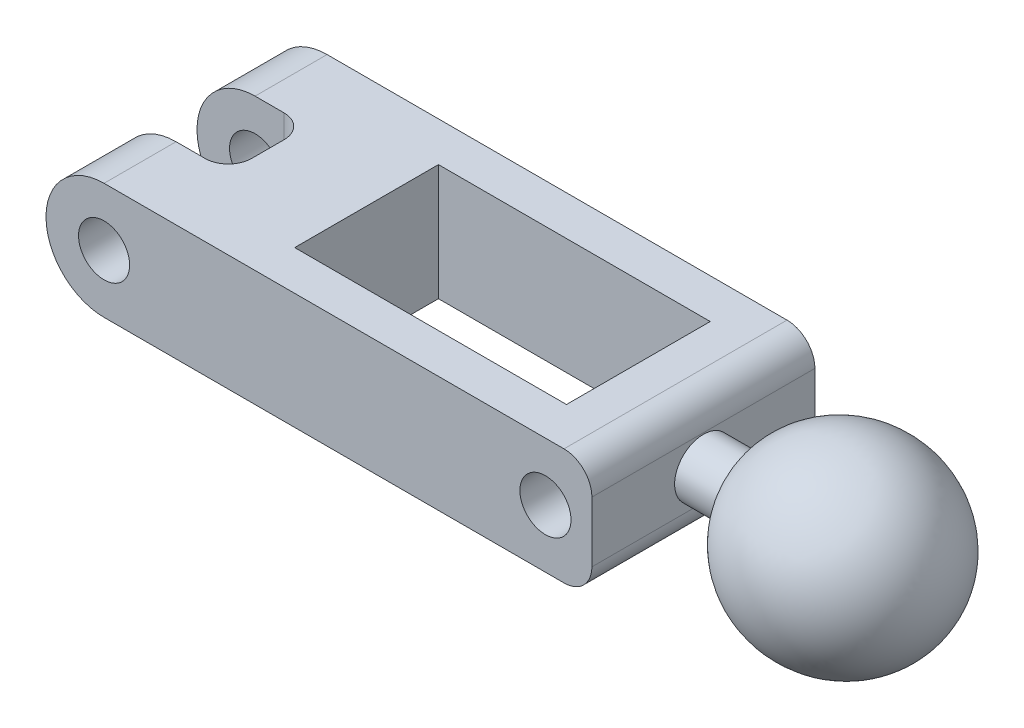
from build123d import *

# Parameters (mm, degrees)
SKETCH1_R           = 1.1
BOSS_EXTRUDE1_DEPTH = 4.8
SKETCH2_W           = 11.7
SKETCH2_H           = 6.188
SKETCH2_W_2         = 4.75
SKETCH2_H_2         = 3.4
CUT_EXTRUDE1_DEPTH  = 4.8
FILLET1_R           = 1


with BuildPart() as part:
    # Sketch1 → Boss-Extrude1 (new, symmetric)
    with BuildSketch(Plane.XY):
        with BuildLine():
            Line((-9.5, -2.5), (9.5, -2.5))
            Line((9.5, -2.5), (10.3, -2.5))
            ThreePointArc((10.3, -2.5), (11.148528137, -2.148528137), (11.5, -1.3))
            Line((11.5, -1.3), (11.5, -0.801473335))
            Line((11.5, -0.801473335), (11.5, 1.3))
            ThreePointArc((11.5, 1.3), (11.148528137, 2.148528137), (10.3, 2.5))
            Line((10.3, 2.5), (9.5, 2.5))
            Line((9.5, 2.5), (-9.5, 2.5))
            ThreePointArc((-9.5, 2.5), (-12, 0), (-9.5, -2.5))
        make_face()
        with Locations((-9.5, 0)):
            Circle(SKETCH1_R, mode=Mode.SUBTRACT)
        with Locations((9.5, 0)):
            Circle(SKETCH1_R, mode=Mode.SUBTRACT)
    extrude(amount=BOSS_EXTRUDE1_DEPTH, both=True)

    # Sketch2 → Cut-Extrude1 (cut, symmetric)
    with BuildSketch(Plane(origin=(0, 0, 0), x_dir=(1, 0, 0), z_dir=(0, 1, 0))):
        with Locations((2.85, 0)):
            Rectangle(SKETCH2_W, SKETCH2_H)
        with Locations((-9.625, 0)):
            Rectangle(SKETCH2_W_2, SKETCH2_H_2)
    extrude(amount=CUT_EXTRUDE1_DEPTH, both=True, mode=Mode.SUBTRACT)

    # Sketch6 → Revolve5 (revolve)
    with BuildSketch(Plane.XY):
        with BuildLine():
            Line((11.5, -1.24), (13.5, -1.24))
            add(Edge.make_bspline(
                [(13.5, -1.24), (14.590825895, -4.518170639), (18.155142557, -3.978926497), (21.719459219, -3.439682355), (21.696199677, 0)],
                knots=[3.442238671, 3.442238671, 3.442238671, 4.862711989, 4.862711989, 6.283185307, 6.283185307, 6.283185307], degree=2, weights=[1, 0.758207592, 1, 0.758207592, 1]))
            Line((21.696199677, 0), (11.5, 0))
            Line((11.5, 0), (11.5, -1.24))
        make_face()
    revolve(axis=Axis((11.5, 0, 0), (1, 0, 0)))

    # Fillet1
    fillet1_edges = [part.edges().sort_by_distance(p)[0] for p in [
        (-7.25, 0, 1.7),
        (-7.25, 0, -1.7),
    ]]
    fillet(fillet1_edges, radius=FILLET1_R)


solid = part.part
